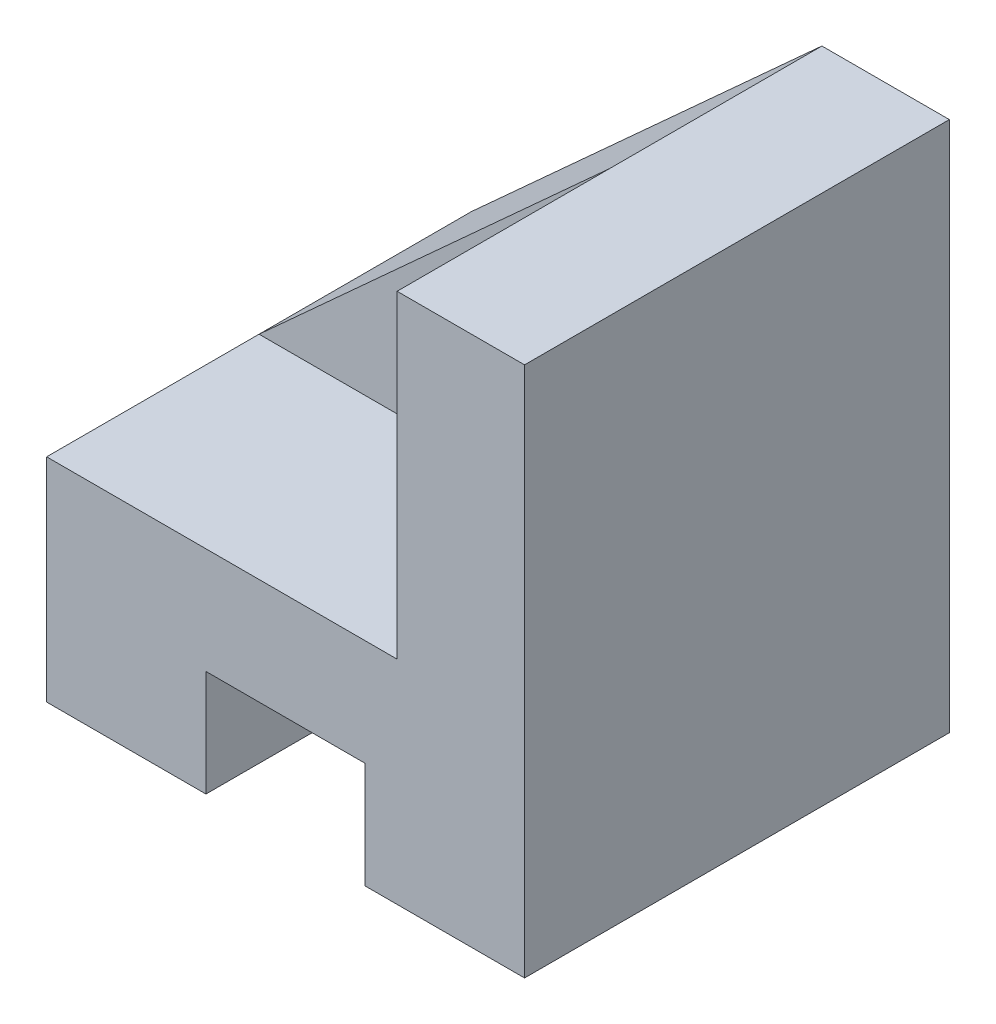
from build123d import *

# Parameters (mm, degrees)
SKETCH1_W                = 45
SKETCH1_H                = 40
BOSS_EXTRUDE1_DEPTH      = 50
SKETCH2_W                = 15
SKETCH2_H                = 10
CUT_EXTRUDE1_DEPTH       = 68.869359802
SKETCH6_W                = 20
SKETCH6_H                = 30
CUT_EXTRUDE15_DEPTH      = 33
CUT_EXTRUDE16_DEPTH      = 59.36308765
CUT_EXTRUDE16_DEPTH_BACK = 20


with BuildPart() as part:
    # Sketch1 → Boss-Extrude1 (new body)
    with BuildSketch(Plane(origin=(0, 0, 0), x_dir=(1, 0, 0), z_dir=(0, 1, 0))):
        Rectangle(SKETCH1_W, SKETCH1_H)
    extrude(amount=BOSS_EXTRUDE1_DEPTH)

    # Sketch2 → Cut-Extrude1 (cut, through all)
    with BuildSketch(Plane.XY.offset(20)):
        with Locations((0, 5)):
            Rectangle(SKETCH2_W, SKETCH2_H)
    extrude(amount=-CUT_EXTRUDE1_DEPTH, mode=Mode.SUBTRACT)

    # Sketch6 → Cut-Extrude15 (cut)
    with BuildSketch(Plane.ZY.offset(22.5)):
        with Locations((10, 35)):
            Rectangle(SKETCH6_W, SKETCH6_H)
    extrude(amount=-CUT_EXTRUDE15_DEPTH, mode=Mode.SUBTRACT)

    # Sketch7 → Cut-Extrude16 (cut, two sides: drawn at the far end of the back side and taken through both)
    with BuildSketch(Plane.XY.offset(-CUT_EXTRUDE16_DEPTH_BACK)):
        Polygon((106.556450077, 137.324045524), (10.5, 50), (-22.5, 20), (-118.556450077, -67.324045524), (-293.204541126, 124.788854629), (-68.091640972, 329.436945678), align=None)
    extrude(amount=CUT_EXTRUDE16_DEPTH + CUT_EXTRUDE16_DEPTH_BACK, mode=Mode.SUBTRACT)


solid = part.part
